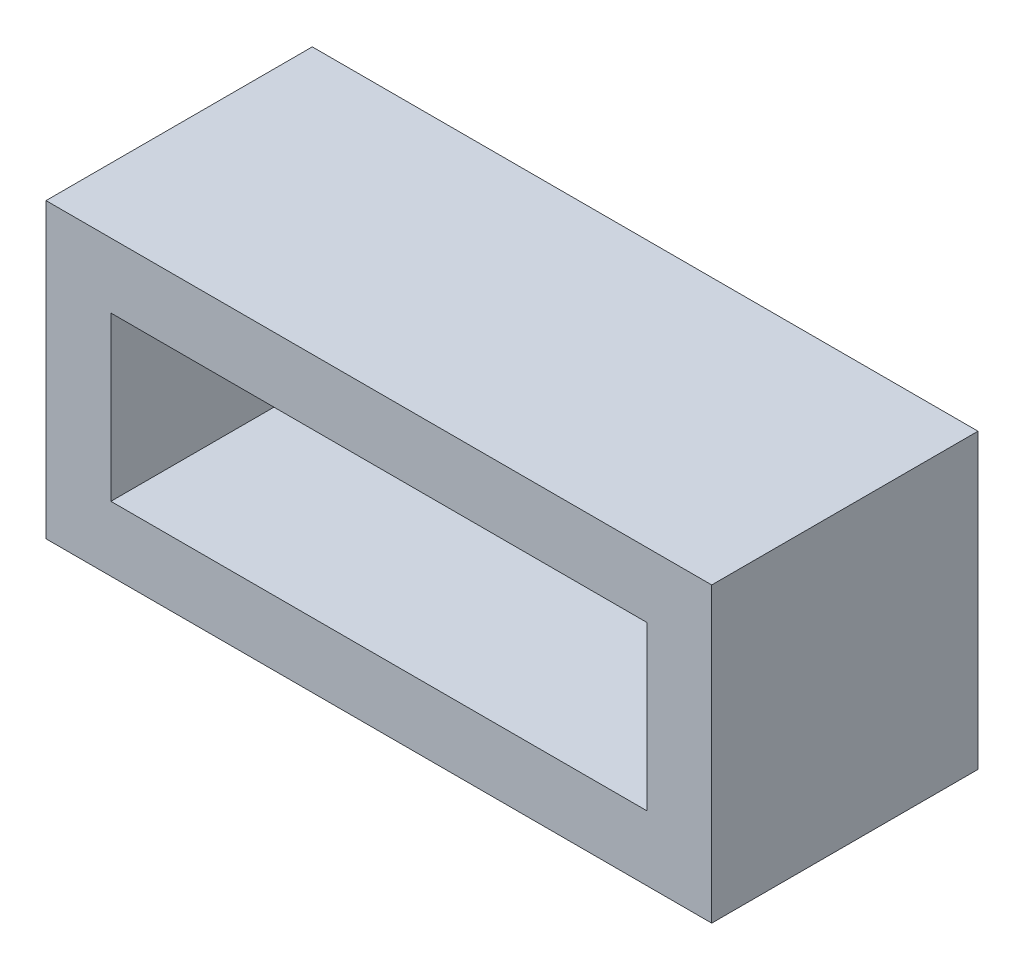
from build123d import *

# Parameters (mm, degrees)
SKETCH1_W           = 25
SKETCH1_H           = 11
SKETCH1_W_2         = 20.126
SKETCH1_H_2         = 6.125
BOSS_EXTRUDE1_DEPTH = 10


with BuildPart() as part:
    # Sketch1 → Boss-Extrude1 (new body)
    with BuildSketch(Plane.XY):
        Rectangle(SKETCH1_W, SKETCH1_H)
        Rectangle(SKETCH1_W_2, SKETCH1_H_2, mode=Mode.SUBTRACT)
    extrude(amount=BOSS_EXTRUDE1_DEPTH)


solid = part.part
